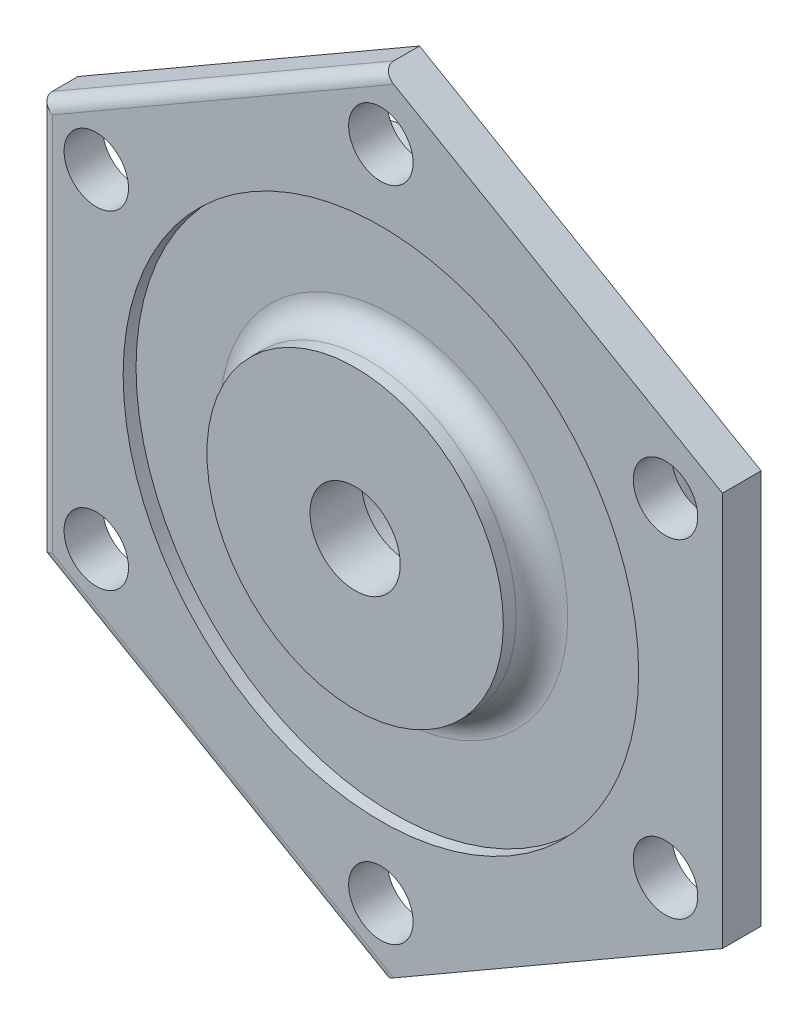
from build123d import *

# Parameters (mm, degrees)
SKETCH1_R            = 14
SKETCH1_R_2          = 7
BOSS_EXTRUDE1_DEPTH  = 8
SKETCH1_3_R          = 23
SKETCH1_3_R_2        = 14
BOSS_EXTRUDE2_DEPTH  = 8
SKETCH1_4_R          = 19
SKETCH1_4_R_2        = 14
BOSS_EXTRUDE3_DEPTH  = 8
SKETCH1_5_R          = 40
SKETCH1_5_R_2        = 23
BOSS_EXTRUDE4_DEPTH  = 2
BOSS_EXTRUDE5_START  = -4
SKETCH1_6_R          = 40
SKETCH1_6_R_2        = 23
BOSS_EXTRUDE5_DEPTH  = 4
BOSS_EXTRUDE6_START  = -8
SKETCH1_8_R          = 45
SKETCH1_8_R_2        = 40
BOSS_EXTRUDE6_DEPTH  = 8
SKETCH1_9_R          = 45
SKETCH1_9_R_2        = 40
BOSS_EXTRUDE7_DEPTH  = 4
BOSS_EXTRUDE8_START  = -2
SKETCH1_10_R         = 5
SKETCH1_10_R_2       = 45
BOSS_EXTRUDE8_DEPTH  = 2
SKETCH1_12_R         = 5
SKETCH1_12_R_2       = 45
BOSS_EXTRUDE10_DEPTH = 4
FILLET1_R            = 4
CHAMFER1_SIZE        = 1
FILLET2_R            = 2


with BuildPart() as part:
    # Sketch1 → Boss-Extrude1 (new body)
    with BuildSketch(Plane.XY):
        Circle(SKETCH1_R)
        Circle(SKETCH1_R_2, mode=Mode.SUBTRACT)
    extrude(amount=BOSS_EXTRUDE1_DEPTH)

    # Sketch1<3> → Boss-Extrude2 (add)
    with BuildSketch(Plane.XY):
        Circle(SKETCH1_3_R)
        Circle(SKETCH1_3_R_2, mode=Mode.SUBTRACT)
    extrude(amount=BOSS_EXTRUDE2_DEPTH)

    # Sketch1<4> → Boss-Extrude3 (add)
    with BuildSketch(Plane.XY):
        Circle(SKETCH1_4_R)
        Circle(SKETCH1_4_R_2, mode=Mode.SUBTRACT)
    extrude(amount=-BOSS_EXTRUDE3_DEPTH)

    # Sketch1<5> → Boss-Extrude4 (add)
    with BuildSketch(Plane.XY):
        Circle(SKETCH1_5_R)
        Circle(SKETCH1_5_R_2, mode=Mode.SUBTRACT)
    extrude(amount=BOSS_EXTRUDE4_DEPTH)

    # Sketch1<6> → Boss-Extrude5 (add)
    with BuildSketch(Plane.XY.offset(BOSS_EXTRUDE5_START)):
        Circle(SKETCH1_6_R)
        Circle(SKETCH1_6_R_2, mode=Mode.SUBTRACT)
    extrude(amount=BOSS_EXTRUDE5_DEPTH)

    # Sketch1<8> → Boss-Extrude6 (add)
    with BuildSketch(Plane.XY.offset(BOSS_EXTRUDE6_START)):
        Circle(SKETCH1_8_R)
        Circle(SKETCH1_8_R_2, mode=Mode.SUBTRACT)
    extrude(amount=BOSS_EXTRUDE6_DEPTH)

    # Sketch1<9> → Boss-Extrude7 (add)
    with BuildSketch(Plane.XY):
        Circle(SKETCH1_9_R)
        Circle(SKETCH1_9_R_2, mode=Mode.SUBTRACT)
    extrude(amount=BOSS_EXTRUDE7_DEPTH)

    # Sketch1<10> → Boss-Extrude8 (add)
    with BuildSketch(Plane.XY.offset(BOSS_EXTRUDE8_START)):
        Polygon((0, -61.199128534), (53, -30.599564267), (53, 30.599564267), (0, 61.199128534), (-53, 30.599564267), (-53, -30.599564267), align=None)
        with Locations((-44.167295593, -25.5)):
            Circle(SKETCH1_10_R, mode=Mode.SUBTRACT)
        with Locations((0, -51)):
            Circle(SKETCH1_10_R, mode=Mode.SUBTRACT)
        with Locations((44.167295593, -25.5)):
            Circle(SKETCH1_10_R, mode=Mode.SUBTRACT)
        with Locations((-44.167295593, 25.5)):
            Circle(SKETCH1_10_R, mode=Mode.SUBTRACT)
        Circle(SKETCH1_10_R_2, mode=Mode.SUBTRACT)
        with Locations((44.167295593, 25.5)):
            Circle(SKETCH1_10_R, mode=Mode.SUBTRACT)
        with Locations((0, 51)):
            Circle(SKETCH1_10_R, mode=Mode.SUBTRACT)
    extrude(amount=BOSS_EXTRUDE8_DEPTH)

    # Sketch1<12> → Boss-Extrude10 (add)
    with BuildSketch(Plane.XY):
        Polygon((0, -61.199128534), (53, -30.599564267), (53, 30.599564267), (0, 61.199128534), (-53, 30.599564267), (-53, -30.599564267), align=None)
        with Locations((-44.167295593, -25.5)):
            Circle(SKETCH1_12_R, mode=Mode.SUBTRACT)
        with Locations((0, -51)):
            Circle(SKETCH1_12_R, mode=Mode.SUBTRACT)
        with Locations((44.167295593, -25.5)):
            Circle(SKETCH1_12_R, mode=Mode.SUBTRACT)
        with Locations((-44.167295593, 25.5)):
            Circle(SKETCH1_12_R, mode=Mode.SUBTRACT)
        Circle(SKETCH1_12_R_2, mode=Mode.SUBTRACT)
        with Locations((44.167295593, 25.5)):
            Circle(SKETCH1_12_R, mode=Mode.SUBTRACT)
        with Locations((0, 51)):
            Circle(SKETCH1_12_R, mode=Mode.SUBTRACT)
    extrude(amount=BOSS_EXTRUDE10_DEPTH)

    # Fillet1
    fillet1_edges = [part.edges().sort_by_distance(p)[0] for p in [
        (-23, 0, 2),
    ]]
    fillet(fillet1_edges, radius=FILLET1_R)

    # Chamfer1
    chamfer1_edges = [part.edges().sort_by_distance(p)[0] for p in [
        (-45, 0, -8),
    ]]
    chamfer(chamfer1_edges, length=CHAMFER1_SIZE)

    # Fillet2
    fillet2_edges = [part.edges().sort_by_distance(p)[0] for p in [
        (-26.5, 45.899346401, 4),
        (-53, 0, 4),
        (-26.5, -45.899346401, 4),
    ]]
    fillet(fillet2_edges, radius=FILLET2_R)


solid = part.part
